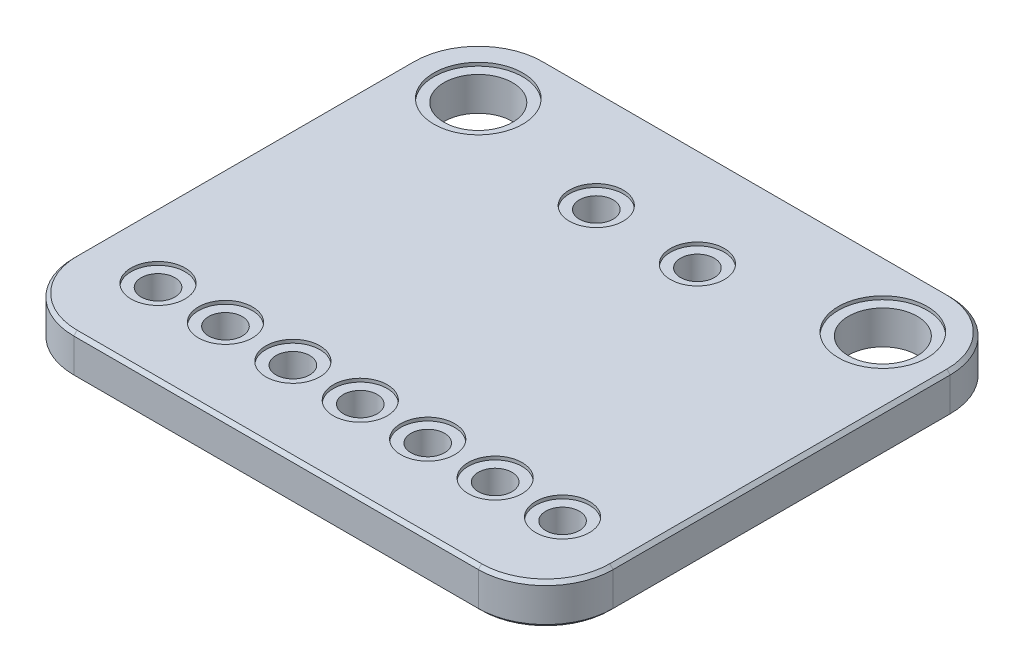
from build123d import *

# Parameters (mm, degrees)
BOSS_EXTRUDE1_DEPTH = 1.524
SKETCH2_R           = 1.294
SKETCH2_R_2         = 0.635
CUT_EXTRUDE1_DEPTH  = 1.524
SKETCH2_4_R         = 1.675
SKETCH2_4_R_2       = 1.294
SKETCH2_4_R_3       = 1.016
SKETCH2_4_R_4       = 0.635
CUT_EXTRUDE2_DEPTH  = 0.127
CHAMFER1_SIZE       = 0.127


with BuildPart() as part:
    # Sketch1 → Boss-Extrude1 (new body)
    with BuildSketch(Plane(origin=(0, 0, 0), x_dir=(1, 0, 0), z_dir=(0, 1, 0))):
        with BuildLine():
            Line((-7.62, -8.89), (7.62, -8.89))
            ThreePointArc((7.62, -8.89), (9.416051224, -8.146051224), (10.16, -6.35))
            Line((10.16, -6.35), (10.16, 6.35))
            ThreePointArc((10.16, 6.35), (9.416051224, 8.146051224), (7.62, 8.89))
            Line((7.62, 8.89), (-7.62, 8.89))
            ThreePointArc((-7.62, 8.89), (-9.416051224, 8.146051224), (-10.16, 6.35))
            Line((-10.16, 6.35), (-10.16, -6.35))
            ThreePointArc((-10.16, -6.35), (-9.416051224, -8.146051224), (-7.62, -8.89))
        make_face()
    extrude(amount=BOSS_EXTRUDE1_DEPTH)

    # Sketch2 → Cut-Extrude1 (cut)
    with BuildSketch(Plane(origin=(0, 1.524, 0), x_dir=(1, 0, 0), z_dir=(0, 1, 0))):
        with Locations((-7.62, 6.35)):
            Circle(SKETCH2_R)
        with Locations((7.62, 6.35)):
            Circle(SKETCH2_R)
        with Locations((-1.905, 5.08)):
            Circle(SKETCH2_R_2)
        with Locations((1.905, 5.08)):
            Circle(SKETCH2_R_2)
        with Locations((-7.62, -5.715)):
            Circle(SKETCH2_R_2)
        with Locations((-5.08, -5.715)):
            Circle(SKETCH2_R_2)
        with Locations((-2.54, -5.715)):
            Circle(SKETCH2_R_2)
        with Locations((0, -5.715)):
            Circle(SKETCH2_R_2)
        with Locations((2.54, -5.715)):
            Circle(SKETCH2_R_2)
        with Locations((5.08, -5.715)):
            Circle(SKETCH2_R_2)
        with Locations((7.62, -5.715)):
            Circle(SKETCH2_R_2)
    extrude(amount=-CUT_EXTRUDE1_DEPTH, mode=Mode.SUBTRACT)

    # Sketch2<4> → Cut-Extrude2 (cut)
    # profile 1 of 11: a face of its own
    with BuildSketch(Plane(origin=(0, 1.524, 0), x_dir=(1, 0, 0), z_dir=(0, 1, 0))):
        with Locations((-7.62, 6.35)):
            Circle(SKETCH2_4_R)
        with Locations((-7.62, 6.35)):
            Circle(SKETCH2_4_R_2, mode=Mode.SUBTRACT)
    # profile 2 of 11: a face of its own
    with BuildSketch(Plane(origin=(0, 1.524, 0), x_dir=(1, 0, 0), z_dir=(0, 1, 0))):
        with Locations((7.62, 6.35)):
            Circle(SKETCH2_4_R)
        with Locations((7.62, 6.35)):
            Circle(SKETCH2_4_R_2, mode=Mode.SUBTRACT)
    # profile 3 of 11: a face of its own
    with BuildSketch(Plane(origin=(0, 1.524, 0), x_dir=(1, 0, 0), z_dir=(0, 1, 0))):
        with Locations((-1.905, 5.08)):
            Circle(SKETCH2_4_R_3)
        with Locations((-1.905, 5.08)):
            Circle(SKETCH2_4_R_4, mode=Mode.SUBTRACT)
    # profile 4 of 11: a face of its own
    with BuildSketch(Plane(origin=(0, 1.524, 0), x_dir=(1, 0, 0), z_dir=(0, 1, 0))):
        with Locations((1.905, 5.08)):
            Circle(SKETCH2_4_R_3)
        with Locations((1.905, 5.08)):
            Circle(SKETCH2_4_R_4, mode=Mode.SUBTRACT)
    # profile 5 of 11: a face of its own
    with BuildSketch(Plane(origin=(0, 1.524, 0), x_dir=(1, 0, 0), z_dir=(0, 1, 0))):
        with Locations((-7.62, -5.715)):
            Circle(SKETCH2_4_R_3)
        with Locations((-7.62, -5.715)):
            Circle(SKETCH2_4_R_4, mode=Mode.SUBTRACT)
    # profile 6 of 11: a face of its own
    with BuildSketch(Plane(origin=(0, 1.524, 0), x_dir=(1, 0, 0), z_dir=(0, 1, 0))):
        with Locations((-5.08, -5.715)):
            Circle(SKETCH2_4_R_3)
        with Locations((-5.08, -5.715)):
            Circle(SKETCH2_4_R_4, mode=Mode.SUBTRACT)
    # profile 7 of 11: a face of its own
    with BuildSketch(Plane(origin=(0, 1.524, 0), x_dir=(1, 0, 0), z_dir=(0, 1, 0))):
        with Locations((-2.54, -5.715)):
            Circle(SKETCH2_4_R_3)
        with Locations((-2.54, -5.715)):
            Circle(SKETCH2_4_R_4, mode=Mode.SUBTRACT)
    # profile 8 of 11: a face of its own
    with BuildSketch(Plane(origin=(0, 1.524, 0), x_dir=(1, 0, 0), z_dir=(0, 1, 0))):
        with Locations((0, -5.715)):
            Circle(SKETCH2_4_R_3)
        with Locations((0, -5.715)):
            Circle(SKETCH2_4_R_4, mode=Mode.SUBTRACT)
    # profile 9 of 11: a face of its own
    with BuildSketch(Plane(origin=(0, 1.524, 0), x_dir=(1, 0, 0), z_dir=(0, 1, 0))):
        with Locations((2.54, -5.715)):
            Circle(SKETCH2_4_R_3)
        with Locations((2.54, -5.715)):
            Circle(SKETCH2_4_R_4, mode=Mode.SUBTRACT)
    # profile 10 of 11: a face of its own
    with BuildSketch(Plane(origin=(0, 1.524, 0), x_dir=(1, 0, 0), z_dir=(0, 1, 0))):
        with Locations((5.08, -5.715)):
            Circle(SKETCH2_4_R_3)
        with Locations((5.08, -5.715)):
            Circle(SKETCH2_4_R_4, mode=Mode.SUBTRACT)
    # profile 11 of 11: a face of its own
    with BuildSketch(Plane(origin=(0, 1.524, 0), x_dir=(1, 0, 0), z_dir=(0, 1, 0))):
        with Locations((7.62, -5.715)):
            Circle(SKETCH2_4_R_3)
        with Locations((7.62, -5.715)):
            Circle(SKETCH2_4_R_4, mode=Mode.SUBTRACT)
    cut_extrude2 = extrude(amount=-CUT_EXTRUDE2_DEPTH, mode=Mode.SUBTRACT)

    # Mirror1: Cut-Extrude2 across plane
    add(cut_extrude2.mirror(Plane.ZX.offset(0.762)), mode=Mode.SUBTRACT)

    # Chamfer1
    chamfer1_edges = [part.edges().sort_by_distance(p)[0] for p in [
        (10.16, 1.524, 0),
        (9.416051224, 1.524, -8.146051224),
        (9.416051224, 1.524, 8.146051224),
        (0, 1.524, -8.89),
        (0, 1.524, 8.89),
        (-9.416051224, 1.524, -8.146051224),
        (-9.416051224, 1.524, 8.146051224),
        (-10.16, 1.524, 0),
        (-9.416051224, 0, -8.146051224),
        (-10.16, 0, 0),
        (-9.416051224, 0, 8.146051224),
        (0, 0, 8.89),
        (9.416051224, 0, 8.146051224),
        (10.16, 0, 0),
        (9.416051224, 0, -8.146051224),
        (0, 0, -8.89),
    ]]
    chamfer(chamfer1_edges, length=CHAMFER1_SIZE)


solid = part.part
